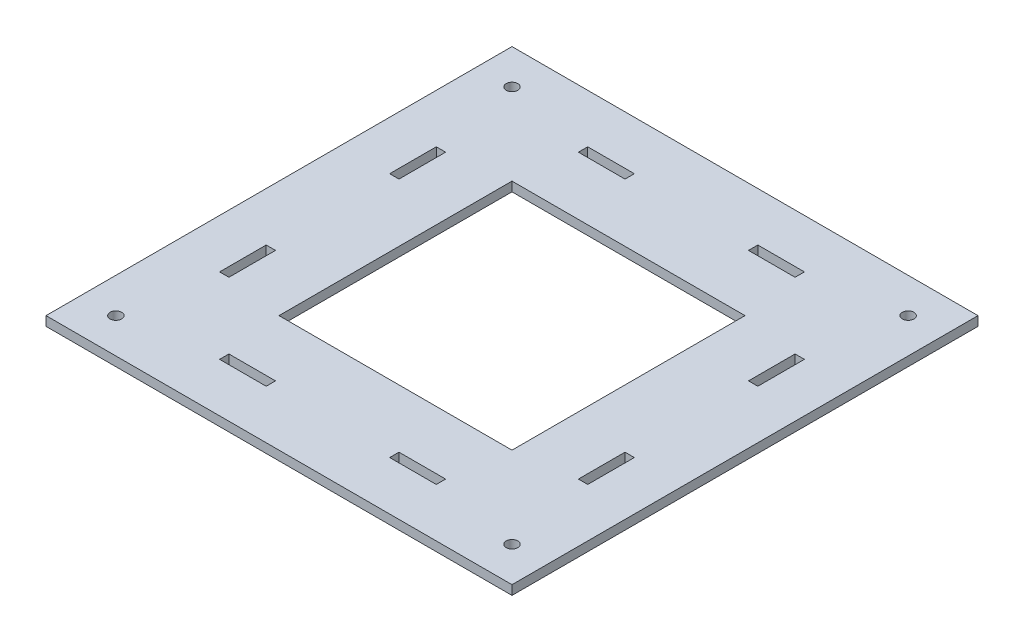
from build123d import *

# Parameters (mm, degrees)
CROQUIS1_W              = 200
CROQUIS1_H              = 200
CROQUIS1_R              = 2.5
SALIENTE_EXTRUIR1_DEPTH = 4
CROQUIS2_W              = 150
CROQUIS2_H              = 150
CROQUIS2_W_2            = 4
CROQUIS2_H_2            = 20
CROQUIS2_W_3            = 20
CROQUIS2_H_3            = 4
CORTAR_EXTRUIR1_DEPTH   = 4
CROQUIS3_W              = 150
CROQUIS3_H              = 150
CROQUIS3_W_2            = 100
CROQUIS3_H_2            = 100
SALIENTE_EXTRUIR2_DEPTH = 4


with BuildPart() as part:
    # Croquis1 → Saliente-Extruir1 (new body)
    with BuildSketch(Plane(origin=(0, 0, 0), x_dir=(1, 0, 0), z_dir=(0, 1, 0))):
        with Locations((100, 100)):
            Rectangle(CROQUIS1_W, CROQUIS1_H)
        with Locations(Location((15, 185, 0), (0, 0, 270))):
            Circle(CROQUIS1_R, mode=Mode.SUBTRACT)
        with Locations(Location((185, 185, 0), (0, 0, 270))):
            Circle(CROQUIS1_R, mode=Mode.SUBTRACT)
        with Locations(Location((185, 15, 0), (0, 0, 270))):
            Circle(CROQUIS1_R, mode=Mode.SUBTRACT)
        with Locations(Location((15, 15, 0), (0, 0, 270))):
            Circle(CROQUIS1_R, mode=Mode.SUBTRACT)
    extrude(amount=SALIENTE_EXTRUIR1_DEPTH)

    # Croquis2 → Cortar-Extruir1 (cut)
    with BuildSketch(Plane(origin=(0, 4, 0), x_dir=(1, 0, 0), z_dir=(0, 1, 0))):
        with Locations((100, 100)):
            Rectangle(CROQUIS2_W, CROQUIS2_H)
        with Locations((23, 136.5)):
            Rectangle(CROQUIS2_W_2, CROQUIS2_H_2)
        with Locations((63.5, 177)):
            Rectangle(CROQUIS2_W_3, CROQUIS2_H_3)
        with Locations((177, 136.5)):
            Rectangle(CROQUIS2_W_2, CROQUIS2_H_2)
        with Locations((136.5, 177)):
            Rectangle(CROQUIS2_W_3, CROQUIS2_H_3)
        with Locations((136.5, 23)):
            Rectangle(CROQUIS2_W_3, CROQUIS2_H_3)
        with Locations((177, 63.5)):
            Rectangle(CROQUIS2_W_2, CROQUIS2_H_2)
        with Locations((23, 63.5)):
            Rectangle(CROQUIS2_W_2, CROQUIS2_H_2)
        with Locations((63.5, 23)):
            Rectangle(CROQUIS2_W_3, CROQUIS2_H_3)
    extrude(amount=-CORTAR_EXTRUIR1_DEPTH, mode=Mode.SUBTRACT)

    # Croquis3 → Saliente-Extruir2 (add)
    with BuildSketch(Plane(origin=(0, 4, 0), x_dir=(1, 0, 0), z_dir=(0, 1, 0))):
        with Locations((100, 100)):
            Rectangle(CROQUIS3_W, CROQUIS3_H)
        with Locations((100, 100)):
            Rectangle(CROQUIS3_W_2, CROQUIS3_H_2, mode=Mode.SUBTRACT)
    extrude(amount=-SALIENTE_EXTRUIR2_DEPTH)


solid = part.part
